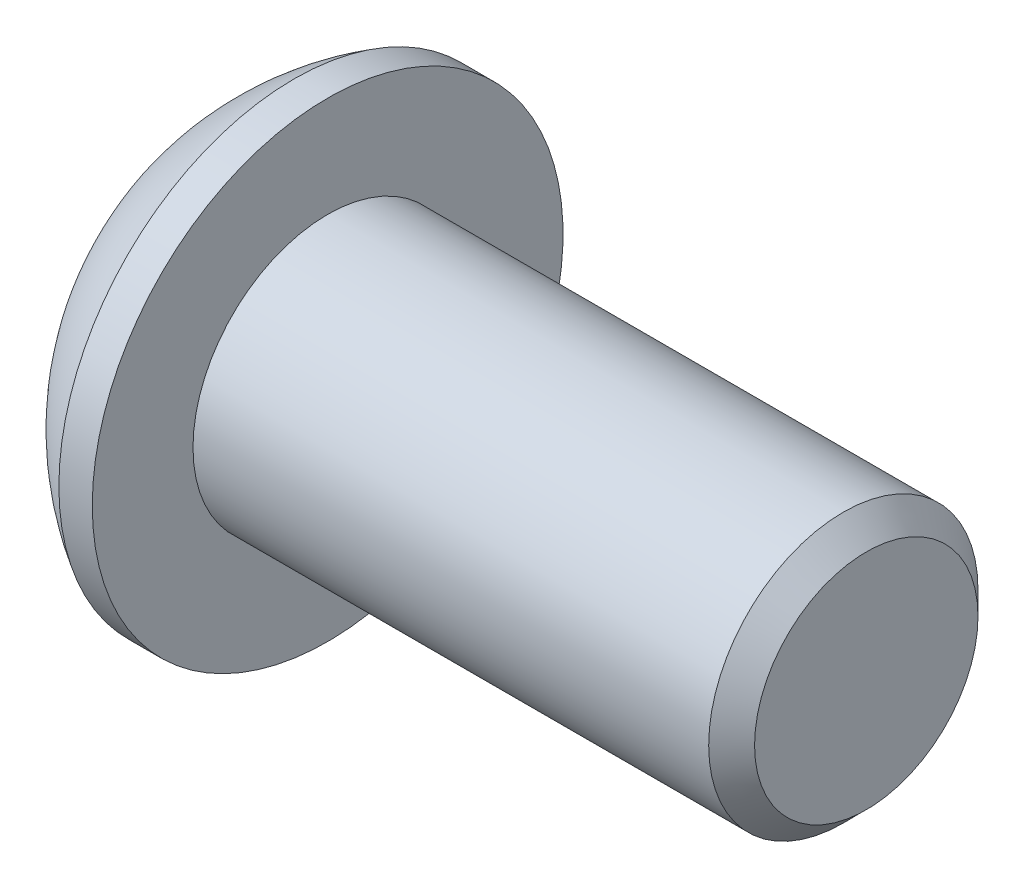
from build123d import *

# Parameters (mm, degrees)
HEX_2_DEPTH = 2.2098


with BuildPart() as part:
    # BodySke → BaseBody (revolve)
    with BuildSketch(Plane.XY, mode=Mode.PRIVATE) as basebody_sk:
        with BuildLine():
            Line((16.0528, 0), (16.0528, 2.63398))
            Line((16.0528, 2.63398), (15.51178, 3.175))
            Line((15.51178, 3.175), (3.3528, 3.175))
            Line((3.3528, 3.175), (3.3528, 5.5499))
            Line((3.3528, 5.5499), (2.5654, 5.5499))
            ThreePointArc((2.5654, 5.5499), (1.073764503, 4.355582759), (0, 2.77495))
            Line((0, 2.77495), (0, 0))
            Line((0, 0), (16.0528, 0))
        make_face()
    revolve(basebody_sk.sketch.rotate(Axis((0, 0, 0), (1, 0, 0)), 90), axis=Axis((0, 0, 0), (1, 0, 0)))

    # Sketch2 → PreBroach (revolve, cut)
    with BuildSketch(Plane.XY, mode=Mode.PRIVATE) as prebroach_sk:
        Polygon((0, 1.9812), (2.2098, 1.9812), (3.353646353, 0), (0, 0), align=None)
    revolve(prebroach_sk.sketch.rotate(Axis((0, 0, 0), (1, 0, 0)), 90), axis=Axis((0, 0, 0), (1, 0, 0)), mode=Mode.SUBTRACT)

    # Sketch3 → Hex 2 (cut)
    with BuildSketch(Plane(origin=(0, 0, 0), x_dir=(0, 0, -1), z_dir=(1, 0, 0))):
        Polygon((-1.9812, -1.143846353), (-1.9812, 1.143846353), (0, 2.287692707), (1.9812, 1.143846353), (1.9812, -1.143846353), (0, -2.287692707), align=None)
    extrude(amount=HEX_2_DEPTH, mode=Mode.SUBTRACT)


solid = part.part
